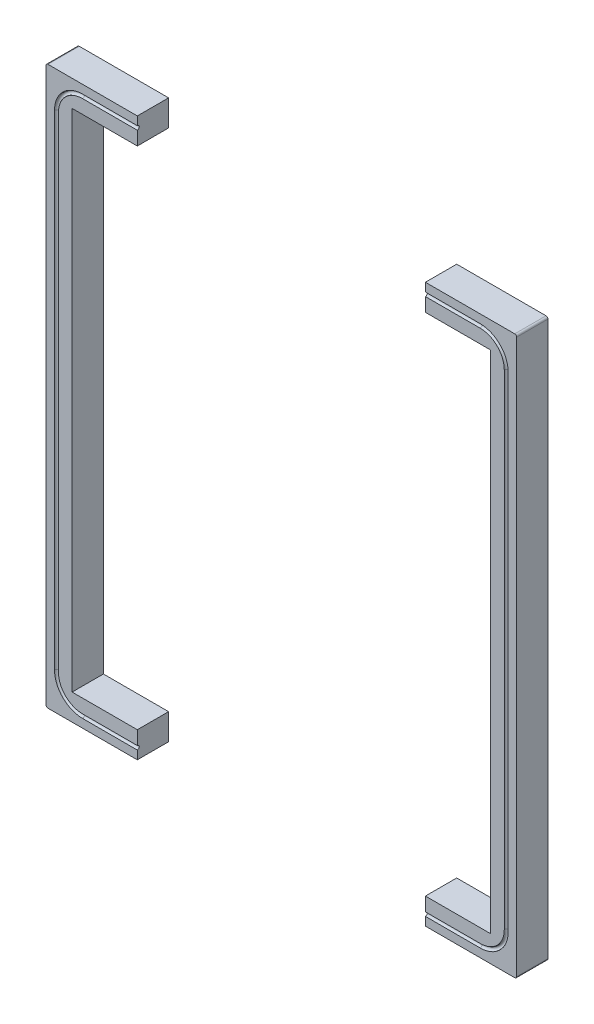
from build123d import *

# Parameters (mm, degrees)
ESBO_O1_W                = 180.47
ESBO_O1_H                = 213.84
RESSALTO_EXTRUS_O1_DEPTH = 12
FILETE2_R                = 0.7366
FILETE3_R                = 0.7366
FILETE4_R                = 0.7366
FILETE5_R                = 0.7366
CORTE_EXTRUS_O1_REACH    = 247.657
ESBO_O2_W                = 160.47
ESBO_O2_H                = 193.84
ESBO_O4_R                = 0.75
CORTE_EXTRUS_O2_REACH    = 240.231
ESBO_O5_W                = 110.47
ESBO_O5_H                = 12
CORTE_EXTRUS_O3_REACH    = 240.231
ESBO_O6_W                = 110.47
ESBO_O6_H                = 12


with BuildPart() as part:
    # Esboço1 → Ressalto-extrusão1 (new body)
    with BuildSketch(Plane.XY):
        with Locations((14.08297041, 115.163100963)):
            Rectangle(ESBO_O1_W, ESBO_O1_H)
    extrude(amount=RESSALTO_EXTRUS_O1_DEPTH)

    # Filete2
    filete2_edges = [part.edges().sort_by_distance(p)[0] for p in [
        (104.31797041, 222.083100963, 6),
    ]]
    fillet(filete2_edges, radius=FILETE2_R)

    # Filete3
    filete3_edges = [part.edges().sort_by_distance(p)[0] for p in [
        (104.31797041, 8.243100963, 6),
    ]]
    fillet(filete3_edges, radius=FILETE3_R)

    # Filete4
    filete4_edges = [part.edges().sort_by_distance(p)[0] for p in [
        (-76.15202959, 8.243100963, 6),
    ]]
    fillet(filete4_edges, radius=FILETE4_R)

    # Filete5
    filete5_edges = [part.edges().sort_by_distance(p)[0] for p in [
        (-76.15202959, 222.083100963, 6),
    ]]
    fillet(filete5_edges, radius=FILETE5_R)

    # Esboço2 → Corte-extrusão1 (cut, up to next)
    with BuildSketch(Plane.XY.offset(12), mode=Mode.PRIVATE) as corte_extrus_o1_sk1:
        with Locations((14.08297041, 115.163100963)):
            Rectangle(ESBO_O2_W, ESBO_O2_H)
    corte_extrus_o1_tool1 = extrude(corte_extrus_o1_sk1.sketch, amount=-CORTE_EXTRUS_O1_REACH, mode=Mode.PRIVATE) & part.part
    add(corte_extrus_o1_tool1.solids().sort_by_distance((14.08297, 115.163101, 12))[0], mode=Mode.SUBTRACT)

    # Varredura de corte1: sweep along a path in Esboço3
    with BuildLine(Plane.XY.offset(12)) as varredura_de_corte1_path:
        Line((-62.15202959, 218.083100963), (90.31797041, 218.083100963))
        ThreePointArc((90.31797041, 218.083100963), (97.389038221, 215.154168775), (100.31797041, 208.083100963))
        Line((100.31797041, 208.083100963), (100.31797041, 22.243100963))
        ThreePointArc((100.31797041, 22.243100963), (97.389038221, 15.172033151), (90.31797041, 12.243100963))
        Line((90.31797041, 12.243100963), (-62.15202959, 12.243100963))
        ThreePointArc((-62.15202959, 12.243100963), (-69.223097402, 15.172033151), (-72.15202959, 22.243100963))
        Line((-72.15202959, 22.243100963), (-72.15202959, 208.083100963))
        ThreePointArc((-72.15202959, 208.083100963), (-69.223097402, 215.154168775), (-62.15202959, 218.083100963))
    # Esboço4 → Varredura de corte1 (sweep, cut)
    with BuildSketch(Plane(origin=(0, 0, 0), x_dir=(0, 0, -1), z_dir=(1, 0, 0))):
        with Locations((-12, 218.083100963)):
            Circle(ESBO_O4_R)
    sweep(path=varredura_de_corte1_path.line, mode=Mode.SUBTRACT)

    # Esboço5 → Corte-extrusão2 (cut, up to next)
    with BuildSketch(Plane(origin=(0, 222.083100963, 0), x_dir=(-1, 0, 0), z_dir=(0, 1, 0)), mode=Mode.PRIVATE) as corte_extrus_o2_sk1:
        with Locations((-14.08297041, 6)):
            Rectangle(ESBO_O5_W, ESBO_O5_H)
    corte_extrus_o2_tool1 = extrude(corte_extrus_o2_sk1.sketch, amount=-CORTE_EXTRUS_O2_REACH, mode=Mode.PRIVATE) & part.part
    add(corte_extrus_o2_tool1.solids().sort_by_distance((14.08297, 222.083101, 6))[0], mode=Mode.SUBTRACT)

    # Esboço6 → Corte-extrusão3 (cut, up to next)
    with BuildSketch(Plane.XZ.offset(-8.243100963), mode=Mode.PRIVATE) as corte_extrus_o3_sk1:
        with Locations((14.08297041, 6)):
            Rectangle(ESBO_O6_W, ESBO_O6_H)
    corte_extrus_o3_tool1 = extrude(corte_extrus_o3_sk1.sketch, amount=-CORTE_EXTRUS_O3_REACH, mode=Mode.PRIVATE) & part.part
    add(corte_extrus_o3_tool1.solids().sort_by_distance((14.08297, 8.243101, 6))[0], mode=Mode.SUBTRACT)


with BuildPart() as corte_extrus_o3_piece_1:
    # of the separate pieces the step leaves, piece 1, a body of its own (corte_extrus_o3_pieces)
    add(part.part.solids().sort_by_distance((-76.15202959, 221.346500963, 0))[0])


with BuildPart() as corte_extrus_o3_piece_2:
    # of the separate pieces the step leaves, piece 2, a body of its own (corte_extrus_o3_pieces)
    add(part.part.solids().sort_by_distance((103.58137041, 8.243100963, 0))[0])


solid = Compound([corte_extrus_o3_piece_1.part, corte_extrus_o3_piece_2.part])
